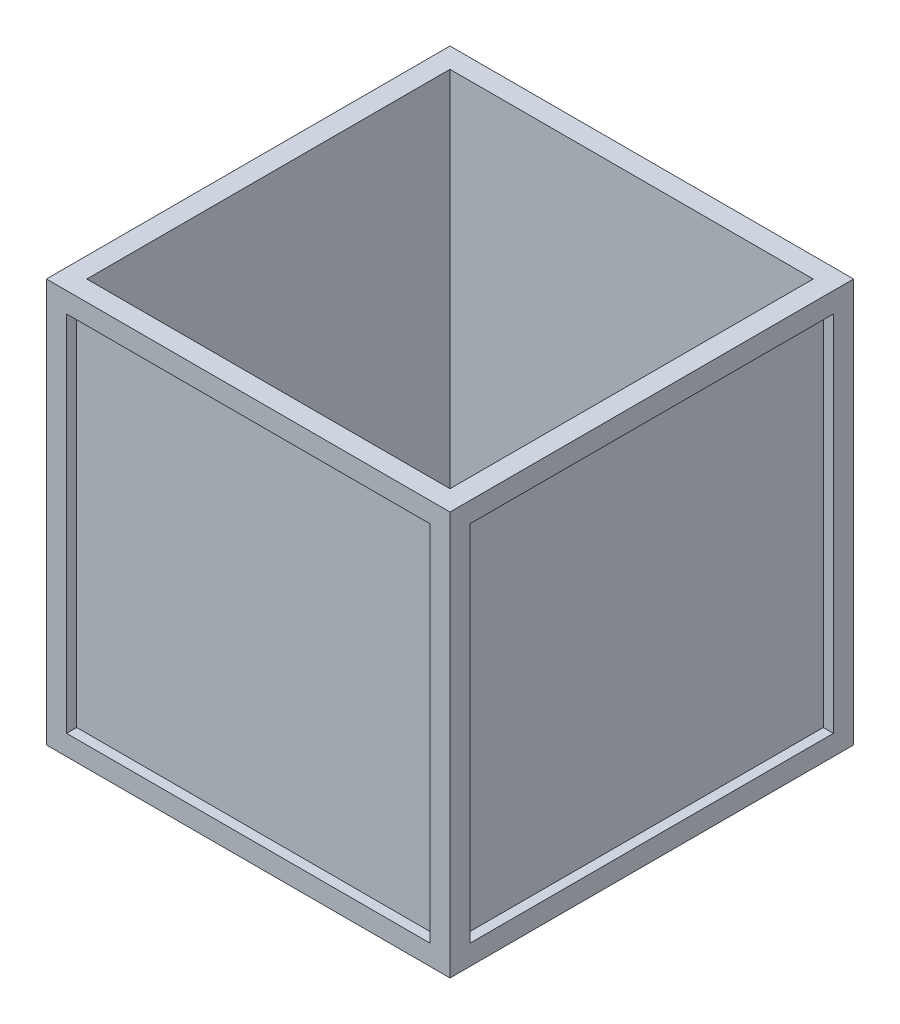
from build123d import *

# Parameters (mm, degrees)
SKETCH1_W           = 50.8
SKETCH1_H           = 50.8
BOSS_EXTRUDE1_DEPTH = 50.8
SHELL1_T            = -2.54
SKETCH2_W           = 45.72
SKETCH2_H           = 45.72
CUT_EXTRUDE1_DEPTH  = 1.27
SKETCH3_W           = 45.72
SKETCH3_H           = 45.72
CUT_EXTRUDE2_DEPTH  = 1.27
SKETCH4_W           = 45.72
SKETCH4_H           = 45.72
CUT_EXTRUDE3_DEPTH  = 1.27
SKETCH5_W           = 45.72
SKETCH5_H           = 45.72
CUT_EXTRUDE4_DEPTH  = 1.27


with BuildPart() as part:
    # Sketch1 → Boss-Extrude1 (new body)
    with BuildSketch(Plane(origin=(0, 0, 0), x_dir=(1, 0, 0), z_dir=(0, 1, 0))):
        Rectangle(SKETCH1_W, SKETCH1_H)
    extrude(amount=BOSS_EXTRUDE1_DEPTH)

    # Shell1
    shell1_openings = [part.faces().sort_by_distance(p)[0] for p in [
        (0, 50.8, 0),
    ]]
    offset(amount=SHELL1_T, openings=shell1_openings, kind=Kind.INTERSECTION)

    # Sketch2 → Cut-Extrude1 (cut)
    with BuildSketch(Plane.XY.offset(25.4)):
        with Locations((0, 25.4)):
            Rectangle(SKETCH2_W, SKETCH2_H)
    extrude(amount=-CUT_EXTRUDE1_DEPTH, mode=Mode.SUBTRACT)

    # Sketch3 → Cut-Extrude2 (cut)
    with BuildSketch(Plane(origin=(25.4, 0, 0), x_dir=(0, 0, -1), z_dir=(1, 0, 0))):
        with Locations((0, 25.4)):
            Rectangle(SKETCH3_W, SKETCH3_H)
    extrude(amount=-CUT_EXTRUDE2_DEPTH, mode=Mode.SUBTRACT)

    # Sketch4 → Cut-Extrude3 (cut)
    with BuildSketch(Plane(origin=(0, 0, -25.4), x_dir=(-1, 0, 0), z_dir=(0, 0, -1))):
        with Locations((0, 25.4)):
            Rectangle(SKETCH4_W, SKETCH4_H)
    extrude(amount=-CUT_EXTRUDE3_DEPTH, mode=Mode.SUBTRACT)

    # Sketch5 → Cut-Extrude4 (cut)
    with BuildSketch(Plane.ZY.offset(25.4)):
        with Locations((0, 25.4)):
            Rectangle(SKETCH5_W, SKETCH5_H)
    extrude(amount=-CUT_EXTRUDE4_DEPTH, mode=Mode.SUBTRACT)


solid = part.part
